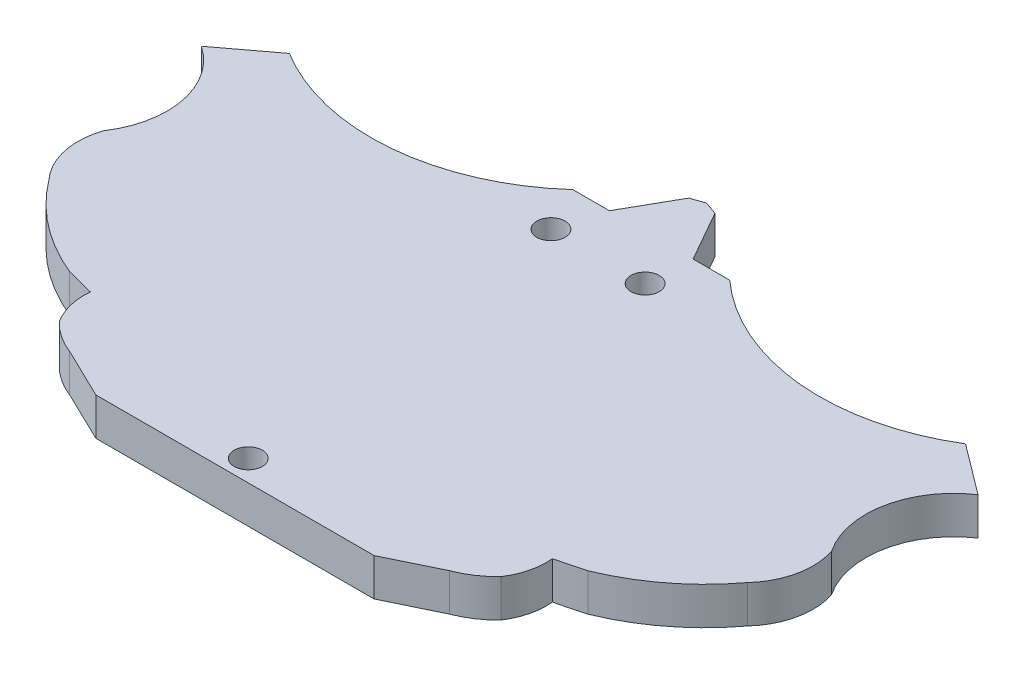
from build123d import *

# Parameters (mm, degrees)
BOSS_EXTRUDE1_DEPTH = 2
SCALE1_SCALE        = 2
SKETCH6_R           = 1.5
CUT_EXTRUDE2_DEPTH  = 3
SKETCH10_R          = 1.5
CUT_EXTRUDE4_DEPTH  = 10


with BuildPart() as part:
    # Sketch2 → Boss-Extrude1 (new body)
    with BuildSketch(Plane(origin=(0, 0, 0), x_dir=(1, 0, 0), z_dir=(0, 1, 0))):
        with BuildLine():
            Line((-17.967387551, 9.159795774), (-20.639475337, 7.15016677))
            ThreePointArc((-20.639475337, 7.15016677), (-18.649238809, 4.17439457), (-19.346117765, 0.662896123))
            ThreePointArc((-19.346117765, 0.662896123), (-19.45411943, -1.286546543), (-18.558961711, -3.021678736))
            ThreePointArc((-18.558961711, -3.021678736), (-16.421478173, -5.190969631), (-13.78312899, -6.712078584))
            ThreePointArc((-13.78312899, -6.712078584), (-13.032173848, -6.916004841), (-12.276686285, -7.102440046))
            ThreePointArc((-12.276686285, -7.102440046), (-12.194265553, -8.245293076), (-11.737308023, -9.296052821))
            ThreePointArc((-11.737308023, -9.296052821), (-10.975506649, -9.937799505), (-10.090124565, -10.394175126))
            Line((-10.090124565, -10.394175126), (-7.391598262, -11.698651137))
            Line((-7.391598262, -11.698651137), (7.391598262, -11.698651137))
            Line((7.391598262, -11.698651137), (10.090124565, -10.394175126))
            ThreePointArc((10.090124565, -10.394175126), (10.975506649, -9.937799505), (11.737308023, -9.296052821))
            ThreePointArc((11.737308023, -9.296052821), (12.194265553, -8.245293076), (12.276686285, -7.102440046))
            ThreePointArc((12.276686285, -7.102440046), (13.032173848, -6.916004841), (13.78312899, -6.712078584))
            ThreePointArc((13.78312899, -6.712078584), (16.421478173, -5.190969631), (18.558961711, -3.021678736))
            ThreePointArc((18.558961711, -3.021678736), (19.45411943, -1.286546543), (19.346117765, 0.662896123))
            ThreePointArc((19.346117765, 0.662896123), (18.649238809, 4.17439457), (20.639475337, 7.15016677))
            Line((20.639475337, 7.15016677), (17.967387551, 9.159795774))
            ThreePointArc((17.967387551, 9.159795774), (10.858325227, 7.499674132), (4.169484372, 10.424426945))
            Line((4.169484372, 10.424426945), (2.224138848, 10.424426945))
            Line((2.224138848, 10.424426945), (0.696104526, 13.114793475))
            Line((0.696104526, 13.114793475), (0, 13.358013588))
            Line((0, 13.358013588), (-0.696104526, 13.114793475))
            Line((-0.696104526, 13.114793475), (-2.224138848, 10.424426945))
            Line((-2.224138848, 10.424426945), (-4.169484372, 10.424426945))
            ThreePointArc((-4.169484372, 10.424426945), (-10.858325227, 7.499674132), (-17.967387551, 9.159795774))
        make_face()
    extrude(amount=BOSS_EXTRUDE1_DEPTH)


with BuildPart() as part_1:
    # Scale1: scaled about (0, 1, 0.242383844)
    add(part.part.scale(SCALE1_SCALE).moved(Location((0, -1, -0.242383844))))

    # Sketch6 → Cut-Extrude2 (cut)
    with BuildSketch(Plane(origin=(0, 3, 0), x_dir=(1, 0, 0), z_dir=(0, 1, 0))):
        with Locations(Location((-5.851533015, 16.28357055, 0), (0, 0, 270))):
            Circle(SKETCH6_R)
        with Locations(Location((4.151829214, 16.28357055, 0), (0, 0, 270))):
            Circle(SKETCH6_R)
    extrude(amount=-CUT_EXTRUDE2_DEPTH, mode=Mode.SUBTRACT)

    # Sketch10 → Cut-Extrude4 (cut)
    with BuildSketch(Plane(origin=(0, 3, 0), x_dir=(1, 0, 0), z_dir=(0, 1, 0))):
        with Locations(Location((-0.8498519, -20.895328087, 0), (0, 0, 270))):
            Circle(SKETCH10_R)
    extrude(amount=-CUT_EXTRUDE4_DEPTH, mode=Mode.SUBTRACT)


solid = part_1.part
